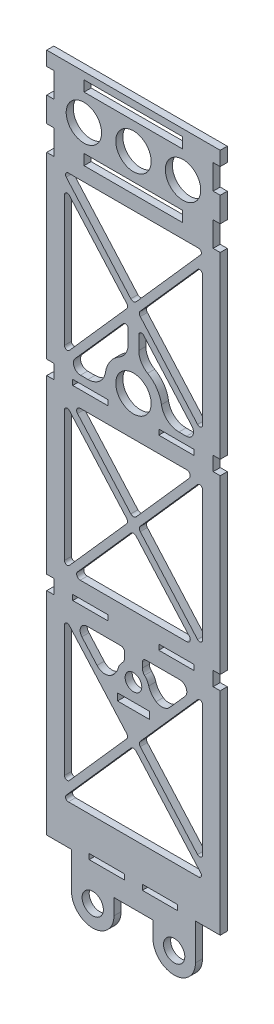
from build123d import *

# Parameters (mm, degrees)
SKETCH_2_R      = 5
SKETCH_2_R_2    = 3
SKETCH_2_R_3    = 2.35
EXTRUDE_1_DEPTH = 2


with BuildPart() as part:
    # 草图2 → 凸台-拉伸1 (new body)
    with BuildSketch(Plane.XY):
        with BuildLine():
            Line((-24.5, 104.119651456), (-24.5, 100.119651456))
            Line((-24.5, 100.119651456), (-22.5, 100.119651456))
            Line((-22.5, 100.119651456), (-22.5, 93.119651456))
            Line((-22.5, 93.119651456), (-24.5, 93.119651456))
            Line((-24.5, 93.119651456), (-24.5, 91.619651456))
            Line((-24.5, 91.619651456), (-24.5, 86.119651456))
            Line((-24.5, 86.119651456), (-22.5, 86.119651456))
            Line((-22.5, 86.119651456), (-22.5, 79.119651456))
            Line((-22.5, 79.119651456), (-24.5, 79.119651456))
            Line((-24.5, 79.119651456), (-24.5, 30.019651456))
            Line((-24.5, 30.019651456), (-24.5, 28.519651456))
            Line((-24.5, 28.519651456), (-22.5, 28.519651456))
            Line((-22.5, 28.519651456), (-22.5, 24.519651456))
            Line((-22.5, 24.519651456), (-24.5, 24.519651456))
            Line((-24.5, 24.519651456), (-24.5, 23.019651456))
            Line((-24.5, 23.019651456), (-24.5, -6.849379626))
            Line((-24.5, -6.849379626), (-24.5, -24.080348544))
            Line((-24.5, -24.080348544), (-22.5, -24.080348544))
            Line((-22.5, -24.080348544), (-22.5, -28.080348544))
            Line((-22.5, -28.080348544), (-24.5, -28.080348544))
            Line((-24.5, -28.080348544), (-24.5, -53.880348544))
            Line((-24.5, -53.880348544), (-24.5, -87.880348544))
            Line((-24.5, -87.880348544), (-17.5, -87.880348544))
            Line((-17.5, -87.880348544), (-17.5, -98.119651456))
            ThreePointArc((-17.5, -98.119651456), (-11.5, -104.119651456), (-5.5, -98.119651456))
            Line((-5.5, -98.119651456), (-5.5, -93.639651456))
            Line((-5.5, -93.639651456), (0, -93.639651456))
            Line((0, -93.639651456), (5.5, -93.639651456))
            Line((5.5, -93.639651456), (5.5, -98.119651456))
            ThreePointArc((5.5, -98.119651456), (11.5, -104.119651456), (17.5, -98.119651456))
            Line((17.5, -98.119651456), (17.5, -87.880348544))
            Line((17.5, -87.880348544), (24.5, -87.880348544))
            Line((24.5, -87.880348544), (24.5, -53.880348544))
            Line((24.5, -53.880348544), (24.5, -28.080348544))
            Line((24.5, -28.080348544), (22.5, -28.080348544))
            Line((22.5, -28.080348544), (22.5, -24.080348544))
            Line((22.5, -24.080348544), (24.5, -24.080348544))
            Line((24.5, -24.080348544), (24.5, -18.634536247))
            Line((24.5, -18.634536247), (24.5, 24.519651456))
            Line((24.5, 24.519651456), (22.5, 24.519651456))
            Line((22.5, 24.519651456), (22.5, 28.519651456))
            Line((22.5, 28.519651456), (24.5, 28.519651456))
            Line((24.5, 28.519651456), (24.5, 79.119651456))
            Line((24.5, 79.119651456), (22.5, 79.119651456))
            Line((22.5, 79.119651456), (22.5, 86.119651456))
            Line((22.5, 86.119651456), (24.5, 86.119651456))
            Line((24.5, 86.119651456), (24.5, 93.119651456))
            Line((24.5, 93.119651456), (22.5, 93.119651456))
            Line((22.5, 93.119651456), (22.5, 100.119651456))
            Line((22.5, 100.119651456), (24.5, 100.119651456))
            Line((24.5, 100.119651456), (24.5, 104.119651456))
            Line((24.5, 104.119651456), (-24.5, 104.119651456))
        make_face()
        with Locations((0, 91.619651456)):
            Circle(SKETCH_2_R, mode=Mode.SUBTRACT)
        with Locations((14, 91.619651456)):
            Circle(SKETCH_2_R, mode=Mode.SUBTRACT)
        with Locations((-14, 91.619651456)):
            Circle(SKETCH_2_R, mode=Mode.SUBTRACT)
        with Locations((0, 32.389660964)):
            Circle(SKETCH_2_R, mode=Mode.SUBTRACT)
        with Locations((11.5, -98.119651456)):
            Circle(SKETCH_2_R_2, mode=Mode.SUBTRACT)
        with Locations((-11.5, -98.119651456)):
            Circle(SKETCH_2_R_2, mode=Mode.SUBTRACT)
        with Locations((0, -38.230975956)):
            Circle(SKETCH_2_R_3, mode=Mode.SUBTRACT)
        Polygon((-13.961191287, 101.119651456), (-13.961191287, 99.119651456), (13.918877001, 99.119651456), (13.918877001, 101.119651456), (13.918877001, 102.119651456), (-13.961191287, 102.119651456), align=None, mode=Mode.SUBTRACT)
        Polygon((0, 84.119651456), (-13.961191287, 84.119651456), (-13.961191287, 81.119651456), (13.918877001, 81.119651456), (13.918877001, 84.119651456), align=None, mode=Mode.SUBTRACT)
        with BuildLine():
            Line((0, 77.119651456), (-18.388776991, 77.119651456))
            ThreePointArc((-18.388776991, 77.119651456), (-19.118191086, 76.648216637), (-18.987927177, 75.789539152))
            Line((-18.987927177, 75.789539152), (-0.748937732, 55.175239454))
            ThreePointArc((-0.748937732, 55.175239454), (0, 54.837879834), (0.748937732, 55.175239454))
            Line((0.748937732, 55.175239454), (18.987927177, 75.789539152))
            ThreePointArc((18.987927177, 75.789539152), (19.118191086, 76.648216637), (18.388776991, 77.119651456))
            Line((18.388776991, 77.119651456), (0, 77.119651456))
        make_face(mode=Mode.SUBTRACT)
        with BuildLine():
            Line((14.955017711, 29.389660964), (12.845232579, 29.389660964))
            ThreePointArc((12.845232579, 29.389660964), (9.593014401, 30.591888337), (7.90475851, 33.620430195))
            ThreePointArc((7.90475851, 33.620430195), (6.598939865, 36.912270019), (4, 39.317864194))
            ThreePointArc((4, 39.317864194), (2.169872981, 41.147991213), (1.5, 43.647991213))
            Line((1.5, 43.647991213), (1.5, 47.503711032))
            ThreePointArc((1.5, 47.503711032), (2.016557015, 48.251815352), (2.899150186, 48.033823336))
            Line((2.899150186, 48.033823336), (3.74468866, 47.078168223))
            Line((3.74468866, 47.078168223), (16.452893175, 32.714941724))
            ThreePointArc((16.452893175, 32.714941724), (16.778552948, 30.568248011), (14.955017711, 29.389660964))
        make_face(mode=Mode.SUBTRACT)
        with BuildLine():
            Line((-12.845232579, 29.389660964), (-14.955017711, 29.389660964))
            ThreePointArc((-14.955017711, 29.389660964), (-16.778552948, 30.568248011), (-16.452893175, 32.714941724))
            Line((-16.452893175, 32.714941724), (-3.74468866, 47.078168223))
            Line((-3.74468866, 47.078168223), (-2.899150186, 48.033823336))
            ThreePointArc((-2.899150186, 48.033823336), (-2.016557015, 48.251815352), (-1.5, 47.503711032))
            Line((-1.5, 47.503711032), (-1.5, 43.647991213))
            ThreePointArc((-1.5, 43.647991213), (-2.169872981, 41.147991213), (-4, 39.317864194))
            ThreePointArc((-4, 39.317864194), (-6.598939865, 36.912270019), (-7.90475851, 33.620430195))
            ThreePointArc((-7.90475851, 33.620430195), (-9.593014401, 30.591888337), (-12.845232579, 29.389660964))
        make_face(mode=Mode.SUBTRACT)
        Polygon((-7.158184264, 25.769651456), (-7.158184264, 26.519651456), (-7.158184264, 27.269651456), (-17.158184264, 27.269651456), (-17.158184264, 25.769651456), align=None, mode=Mode.SUBTRACT)
        Polygon((7.158184264, 25.769651456), (7.158184264, 26.519651456), (7.158184264, 27.269651456), (17.158184264, 27.269651456), (17.158184264, 25.769651456), align=None, mode=Mode.SUBTRACT)
        with BuildLine():
            Line((-18.100849814, 19.168707057), (-1.921511244, 0.882291836))
            ThreePointArc((-1.921511244, 0.882291836), (-1.670448976, 0.219651456), (-1.921511244, -0.442988924))
            Line((-1.921511244, -0.442988924), (-18.100849814, -18.729404145))
            ThreePointArc((-18.100849814, -18.729404145), (-18.983442985, -18.947396161), (-19.5, -18.199291841))
            Line((-19.5, -18.199291841), (-19.5, -11.080348544))
            Line((-19.5, -11.080348544), (-19.5, 18.638594753))
            ThreePointArc((-19.5, 18.638594753), (-18.983442985, 19.386699073), (-18.100849814, 19.168707057))
        make_face(mode=Mode.SUBTRACT)
        with BuildLine():
            Line((0.748937732, -2.135936542), (15.790089995, -19.135936542))
            ThreePointArc((15.790089995, -19.135936542), (15.952919882, -20.209283399), (15.041152263, -20.798576922))
            Line((15.041152263, -20.798576922), (0, -20.798576922))
            Line((0, -20.798576922), (-15.041152263, -20.798576922))
            ThreePointArc((-15.041152263, -20.798576922), (-15.952919882, -20.209283399), (-15.790089995, -19.135936542))
            Line((-15.790089995, -19.135936542), (-0.748937732, -2.135936542))
            ThreePointArc((-0.748937732, -2.135936542), (0, -1.798576922), (0.748937732, -2.135936542))
        make_face(mode=Mode.SUBTRACT)
        with BuildLine():
            Line((-15.790089995, 19.575239454), (-3.74468866, 5.961134689))
            Line((-3.74468866, 5.961134689), (-2.899150186, 5.005479576))
            Line((-2.899150186, 5.005479576), (-0.748937732, 2.575239454))
            ThreePointArc((-0.748937732, 2.575239454), (0, 2.237879834), (0.748937732, 2.575239454))
            Line((0.748937732, 2.575239454), (2.899150186, 5.005479576))
            Line((2.899150186, 5.005479576), (3.74468866, 5.961134689))
            Line((3.74468866, 5.961134689), (15.790089995, 19.575239454))
            ThreePointArc((15.790089995, 19.575239454), (15.952919882, 20.648586311), (15.041152263, 21.237879834))
            Line((15.041152263, 21.237879834), (0, 21.237879834))
            Line((0, 21.237879834), (-15.041152263, 21.237879834))
            ThreePointArc((-15.041152263, 21.237879834), (-15.952919882, 20.648586311), (-15.790089995, 19.575239454))
        make_face(mode=Mode.SUBTRACT)
        with BuildLine():
            Line((1.921511244, -0.442988924), (18.100849814, -18.729404145))
            ThreePointArc((18.100849814, -18.729404145), (18.983442985, -18.947396161), (19.5, -18.199291841))
            Line((19.5, -18.199291841), (19.5, 18.638594753))
            ThreePointArc((19.5, 18.638594753), (18.983442985, 19.386699073), (18.100849814, 19.168707057))
            Line((18.100849814, 19.168707057), (1.921511244, 0.882291836))
            ThreePointArc((1.921511244, 0.882291836), (1.670448976, 0.219651456), (1.921511244, -0.442988924))
        make_face(mode=Mode.SUBTRACT)
        Polygon((-7.158184264, -26.830348544), (-7.158184264, -26.080348544), (-7.158184264, -25.330348544), (-17.158184264, -25.330348544), (-17.158184264, -26.830348544), align=None, mode=Mode.SUBTRACT)
        Polygon((7.158184264, -26.830348544), (7.158184264, -26.080348544), (7.158184264, -25.330348544), (17.158184264, -25.330348544), (17.158184264, -26.830348544), align=None, mode=Mode.SUBTRACT)
        with BuildLine():
            Line((0, -76.680348544), (-18.388776991, -76.680348544))
            ThreePointArc((-18.388776991, -76.680348544), (-19.118191086, -76.208913725), (-18.987927177, -75.35023624))
            Line((-18.987927177, -75.35023624), (-0.748937732, -54.735936542))
            ThreePointArc((-0.748937732, -54.735936542), (0, -54.398576922), (0.748937732, -54.735936542))
            Line((0.748937732, -54.735936542), (18.987927177, -75.35023624))
            ThreePointArc((18.987927177, -75.35023624), (19.118191086, -76.208913725), (18.388776991, -76.680348544))
            Line((18.388776991, -76.680348544), (0, -76.680348544))
        make_face(mode=Mode.SUBTRACT)
        with BuildLine():
            Line((-18.100849814, -33.431292943), (-1.921511244, -51.717708164))
            ThreePointArc((-1.921511244, -51.717708164), (-1.670448976, -52.380348544), (-1.921511244, -53.042988924))
            Line((-1.921511244, -53.042988924), (-18.100849814, -71.329404145))
            ThreePointArc((-18.100849814, -71.329404145), (-18.983442985, -71.547396161), (-19.5, -70.799291841))
            Line((-19.5, -70.799291841), (-19.5, -41.080348544))
            Line((-19.5, -41.080348544), (-19.5, -33.961405247))
            ThreePointArc((-19.5, -33.961405247), (-18.983442985, -33.213300927), (-18.100849814, -33.431292943))
        make_face(mode=Mode.SUBTRACT)
        with BuildLine():
            Line((1.921511244, -53.042988924), (18.100849814, -71.329404145))
            ThreePointArc((18.100849814, -71.329404145), (18.983442985, -71.547396161), (19.5, -70.799291841))
            Line((19.5, -70.799291841), (19.5, -33.961405247))
            ThreePointArc((19.5, -33.961405247), (18.983442985, -33.213300927), (18.100849814, -33.431292943))
            Line((18.100849814, -33.431292943), (1.921511244, -51.717708164))
            ThreePointArc((1.921511244, -51.717708164), (1.670448976, -52.380348544), (1.921511244, -53.042988924))
        make_face(mode=Mode.SUBTRACT)
        Polygon((-2.5, -87.880348544), (-2.5, -87.130348544), (-2.5, -86.380348544), (-12.5, -86.380348544), (-12.5, -87.880348544), align=None, mode=Mode.SUBTRACT)
        Polygon((2.5, -87.880348544), (2.5, -87.130348544), (2.5, -86.380348544), (12.5, -86.380348544), (12.5, -87.880348544), align=None, mode=Mode.SUBTRACT)
        with BuildLine():
            Line((-18.100849814, 71.768707057), (-1.921511244, 53.482291836))
            ThreePointArc((-1.921511244, 53.482291836), (-1.670448976, 52.819651456), (-1.921511244, 52.157011076))
            Line((-1.921511244, 52.157011076), (-18.100849814, 33.870595855))
            ThreePointArc((-18.100849814, 33.870595855), (-18.983442985, 33.652603839), (-19.5, 34.400708159))
            Line((-19.5, 34.400708159), (-19.5, 41.519651456))
            Line((-19.5, 41.519651456), (-19.5, 71.238594753))
            ThreePointArc((-19.5, 71.238594753), (-18.983442985, 71.986699073), (-18.100849814, 71.768707057))
        make_face(mode=Mode.SUBTRACT)
        with BuildLine():
            Line((1.921511244, 52.157011076), (18.100849814, 33.870595855))
            ThreePointArc((18.100849814, 33.870595855), (18.983442985, 33.652603839), (19.5, 34.400708159))
            Line((19.5, 34.400708159), (19.5, 71.238594753))
            ThreePointArc((19.5, 71.238594753), (18.983442985, 71.986699073), (18.100849814, 71.768707057))
            Line((18.100849814, 71.768707057), (1.921511244, 53.482291836))
            ThreePointArc((1.921511244, 53.482291836), (1.670448976, 52.819651456), (1.921511244, 52.157011076))
        make_face(mode=Mode.SUBTRACT)
        with BuildLine():
            Line((-14.568333687, -34.405629304), (-10.283652037, -39.248316006))
            ThreePointArc((-10.283652037, -39.248316006), (-8.444190363, -40.232610325), (-6.407731023, -39.77952323))
            ThreePointArc((-6.407731023, -39.77952323), (-5.111604603, -38.565841655), (-4.321378762, -36.975712798))
            ThreePointArc((-4.321378762, -36.975712798), (-3.849457929, -35.900380827), (-3.115384615, -34.983765045))
            ThreePointArc((-3.115384615, -34.983765045), (-2.660267578, -34.325024736), (-2.5, -33.540560196))
            Line((-2.5, -33.540560196), (-2.5, -32.080348544))
            ThreePointArc((-2.5, -32.080348544), (-2.792893219, -31.373241763), (-3.5, -31.080348544))
            Line((-3.5, -31.080348544), (-13.070458223, -31.080348544))
            ThreePointArc((-13.070458223, -31.080348544), (-14.89399346, -32.258935591), (-14.568333687, -34.405629304))
        make_face(mode=Mode.SUBTRACT)
        with BuildLine():
            Line((14.568333687, -34.405629304), (10.283652037, -39.248316006))
            ThreePointArc((10.283652037, -39.248316006), (8.444190363, -40.232610325), (6.407731023, -39.77952323))
            ThreePointArc((6.407731023, -39.77952323), (5.111604603, -38.565841655), (4.321378762, -36.975712798))
            ThreePointArc((4.321378762, -36.975712798), (3.849457929, -35.900380827), (3.115384615, -34.983765045))
            ThreePointArc((3.115384615, -34.983765045), (2.660267578, -34.325024736), (2.5, -33.540560196))
            Line((2.5, -33.540560196), (2.5, -32.080348544))
            ThreePointArc((2.5, -32.080348544), (2.792893219, -31.373241763), (3.5, -31.080348544))
            Line((3.5, -31.080348544), (13.070458223, -31.080348544))
            ThreePointArc((13.070458223, -31.080348544), (14.89399346, -32.258935591), (14.568333687, -34.405629304))
        make_face(mode=Mode.SUBTRACT)
        Polygon((0, -43.080975956), (-4.5, -43.080975956), (-4.5, -45.080975956), (4.5, -45.080975956), (4.5, -43.080975956), align=None, mode=Mode.SUBTRACT)
    extrude(amount=EXTRUDE_1_DEPTH)


solid = part.part
